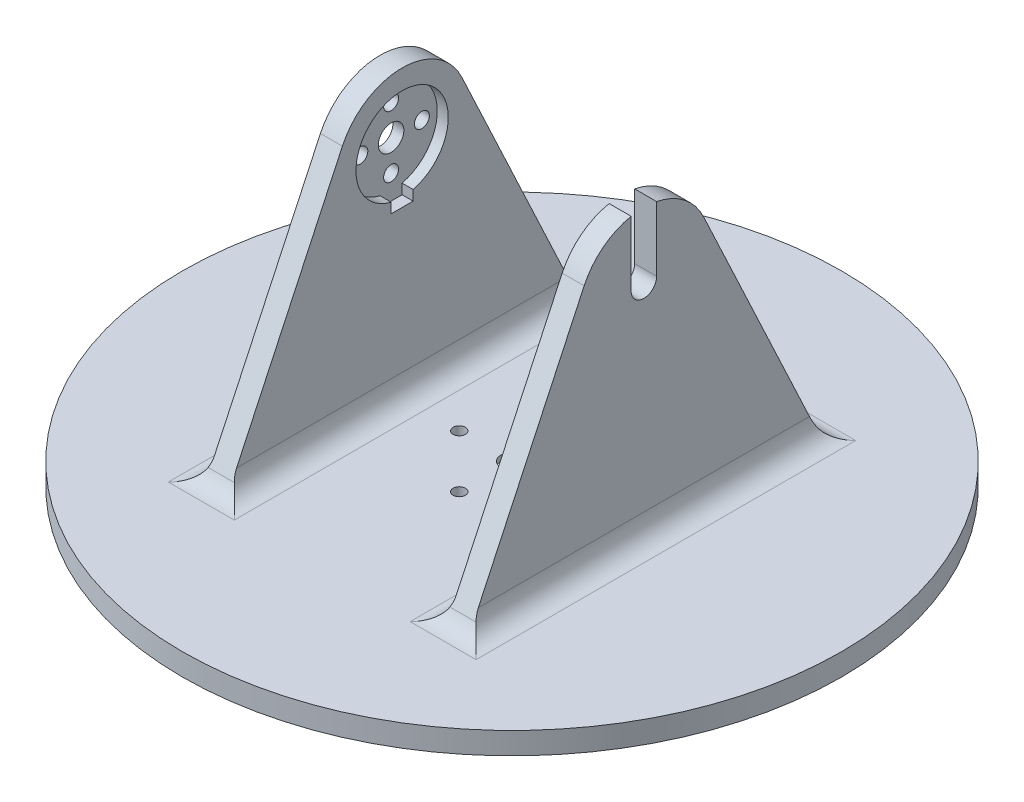
from build123d import *

# Parameters (mm, degrees)
SKETCH1_R           = 75
BOSS_EXTRUDE1_DEPTH = 5
BOSS_EXTRUDE2_DEPTH = 5
BOSS_EXTRUDE3_START = -5
BOSS_EXTRUDE3_DEPTH = 5
SKETCH6_R           = 1.5
CUT_EXTRUDE1_DEPTH  = 5
SKETCH7_R           = 2.9
CUT_EXTRUDE2_DEPTH  = 2.5
SKETCH8_R           = 0.6
CUT_EXTRUDE3_DEPTH  = 5
CIRPATTERN1_COUNT   = 4
SKETCH10_R          = 1.7
CUT_EXTRUDE4_DEPTH  = 3
CIRPATTERN2_COUNT   = 4
SKETCH11_R          = 2.5
CUT_EXTRUDE5_DEPTH  = 5
SKETCH12_R          = 1.4
CUT_EXTRUDE6_DEPTH  = 5
CIRPATTERN3_COUNT   = 4
SKETCH16_R          = 10.5
CUT_EXTRUDE10_DEPTH = 2.5
CUT_EXTRUDE11_DEPTH = 5
FILLET1_R           = 5
SKETCH19_R          = 15.25
CUT_EXTRUDE12_DEPTH = 2
SKETCH20_W          = 5
SKETCH20_H          = 4
CUT_EXTRUDE13_DEPTH = 2.5
SKETCH21_R          = 6.5
CUT_EXTRUDE14_DEPTH = 1.75


with BuildPart() as part:
    # Sketch1 → Boss-Extrude1 (new body)
    with BuildSketch(Plane(origin=(0, 0, 0), x_dir=(1, 0, 0), z_dir=(0, 1, 0))):
        with Locations(Location((0, 0, 0), (0, 0, 270))):
            Circle(SKETCH1_R)
    extrude(amount=BOSS_EXTRUDE1_DEPTH)

    # Sketch4 → Boss-Extrude2 (add)
    with BuildSketch(Plane.ZY.offset(25)):
        with BuildLine():
            Line((-13.582225242, 61.365780194), (-40, 5))
            Line((-40, 5), (40, 5))
            Line((40, 5), (13.582225242, 61.365780194))
            ThreePointArc((13.582225242, 61.365780194), (0, 70), (-13.582225242, 61.365780194))
        make_face()
    extrude(amount=BOSS_EXTRUDE2_DEPTH)

    # Sketch5 → Boss-Extrude3 (add)
    with BuildSketch(Plane.ZY.offset(-25).offset(BOSS_EXTRUDE3_START)):
        with BuildLine():
            Line((13.582225242, 61.365780194), (40, 5))
            Line((40, 5), (-40, 5))
            Line((-40, 5), (-13.582225242, 61.365780194))
            ThreePointArc((-13.582225242, 61.365780194), (0, 70), (13.582225242, 61.365780194))
        make_face()
    extrude(amount=BOSS_EXTRUDE3_DEPTH)

    # Sketch6 → Cut-Extrude1 (cut)
    with BuildSketch(Plane.ZY.offset(30)):
        with Locations((0, 55)):
            Circle(SKETCH6_R)
    extrude(amount=-CUT_EXTRUDE1_DEPTH, mode=Mode.SUBTRACT)

    # Sketch7 → Cut-Extrude2 (cut)
    with BuildSketch(Plane.ZY.offset(30)):
        with Locations((0, 55)):
            Circle(SKETCH7_R)
    extrude(amount=-CUT_EXTRUDE2_DEPTH, mode=Mode.SUBTRACT)

    # Sketch8 → Cut-Extrude3 (cut)
    with BuildSketch(Plane.ZY.offset(30)):
        with Locations((0, 62.25)):
            Circle(SKETCH8_R)
    cut_extrude3 = extrude(amount=-CUT_EXTRUDE3_DEPTH, mode=Mode.SUBTRACT)

    # CirPattern1: Cut-Extrude3 ×4 about axis
    cirpattern1_axis = Axis((0, 55, 0), (1, 0, 0))
    for i in range(1, CIRPATTERN1_COUNT):
        add(cut_extrude3.rotate(cirpattern1_axis, i * 360 / CIRPATTERN1_COUNT), mode=Mode.SUBTRACT)

    # Sketch10 → Cut-Extrude4 (cut)
    with BuildSketch(Plane.ZY.offset(30)):
        with Locations((0, 62)):
            Circle(SKETCH10_R)
    cut_extrude4 = extrude(amount=-CUT_EXTRUDE4_DEPTH, mode=Mode.SUBTRACT)

    # CirPattern2: Cut-Extrude4 ×4 about axis
    cirpattern2_axis = Axis((0, 55, 0), (1, 0, 0))
    for i in range(1, CIRPATTERN2_COUNT):
        add(cut_extrude4.rotate(cirpattern2_axis, i * 360 / CIRPATTERN2_COUNT), mode=Mode.SUBTRACT)

    # Sketch11 → Cut-Extrude5 (cut)
    with BuildSketch(Plane(origin=(0, 5, 0), x_dir=(1, 0, 0), z_dir=(0, 1, 0))):
        with Locations(Location((0, 0, 0), (0, 0, 270))):
            Circle(SKETCH11_R)
    extrude(amount=-CUT_EXTRUDE5_DEPTH, mode=Mode.SUBTRACT)

    # Sketch12 → Cut-Extrude6 (cut)
    with BuildSketch(Plane(origin=(0, 5, 0), x_dir=(1, 0, 0), z_dir=(0, 1, 0))):
        with Locations(Location((0, 12, 0), (0, 0, 270))):
            Circle(SKETCH12_R)
    cut_extrude6 = extrude(amount=-CUT_EXTRUDE6_DEPTH, mode=Mode.SUBTRACT)

    # CirPattern3: Cut-Extrude6 ×4 about axis
    cirpattern3_axis = Axis((0, 0, 0), (0, 1, 0))
    for i in range(1, CIRPATTERN3_COUNT):
        add(cut_extrude6.rotate(cirpattern3_axis, i * 360 / CIRPATTERN3_COUNT), mode=Mode.SUBTRACT)

    # Sketch16 → Cut-Extrude10 (cut)
    with BuildSketch(Plane(origin=(-25, 0, 0), x_dir=(0, 0, -1), z_dir=(1, 0, 0))):
        with Locations((0, 55)):
            Circle(SKETCH16_R)
    extrude(amount=-CUT_EXTRUDE10_DEPTH, mode=Mode.SUBTRACT)

    # Sketch18 → Cut-Extrude11 (cut)
    with BuildSketch(Plane(origin=(30, 0, 0), x_dir=(0, 0, -1), z_dir=(1, 0, 0))):
        with BuildLine():
            Line((-2.9, 55), (-2.9, 69.716996976))
            ThreePointArc((-2.9, 69.716996976), (0, 70), (2.9, 69.716996976))
            Line((2.9, 69.716996976), (2.9, 55))
            ThreePointArc((2.9, 55), (0, 52.1), (-2.9, 55))
        make_face()
    extrude(amount=-CUT_EXTRUDE11_DEPTH, mode=Mode.SUBTRACT)

    # Fillet1
    fillet1_edges = [part.edges().sort_by_distance(p)[0] for p in [
        (30, 5, 0),
        (27.5, 5, 40),
        (27.5, 5, -40),
        (25, 5, 0),
        (-25, 5, 0),
        (-27.5, 5, -40),
        (-27.5, 5, 40),
        (-30, 5, 0),
    ]]
    fillet(fillet1_edges, radius=FILLET1_R)

    # Sketch19 → Cut-Extrude12 (cut)
    with BuildSketch(Plane(origin=(0, 0, 0), x_dir=(-1, 0, 0), z_dir=(0, -1, 0))):
        with Locations(Location((0, 0, 0), (0, 0, 90))):
            Circle(SKETCH19_R)
    extrude(amount=-CUT_EXTRUDE12_DEPTH, mode=Mode.SUBTRACT)

    # Sketch20 → Cut-Extrude13 (cut)
    with BuildSketch(Plane(origin=(-25, 0, 0), x_dir=(0, 0, -1), z_dir=(1, 0, 0))):
        with Locations((0, 44.5)):
            Rectangle(SKETCH20_W, SKETCH20_H)
    extrude(amount=-CUT_EXTRUDE13_DEPTH, mode=Mode.SUBTRACT)

    # Sketch21 → Cut-Extrude14 (cut)
    with BuildSketch(Plane(origin=(0, 2, 0), x_dir=(-1, 0, 0), z_dir=(0, -1, 0))):
        with Locations(Location((0, 0, 0), (0, 0, 90))):
            Circle(SKETCH21_R)
    extrude(amount=-CUT_EXTRUDE14_DEPTH, mode=Mode.SUBTRACT)


solid = part.part
